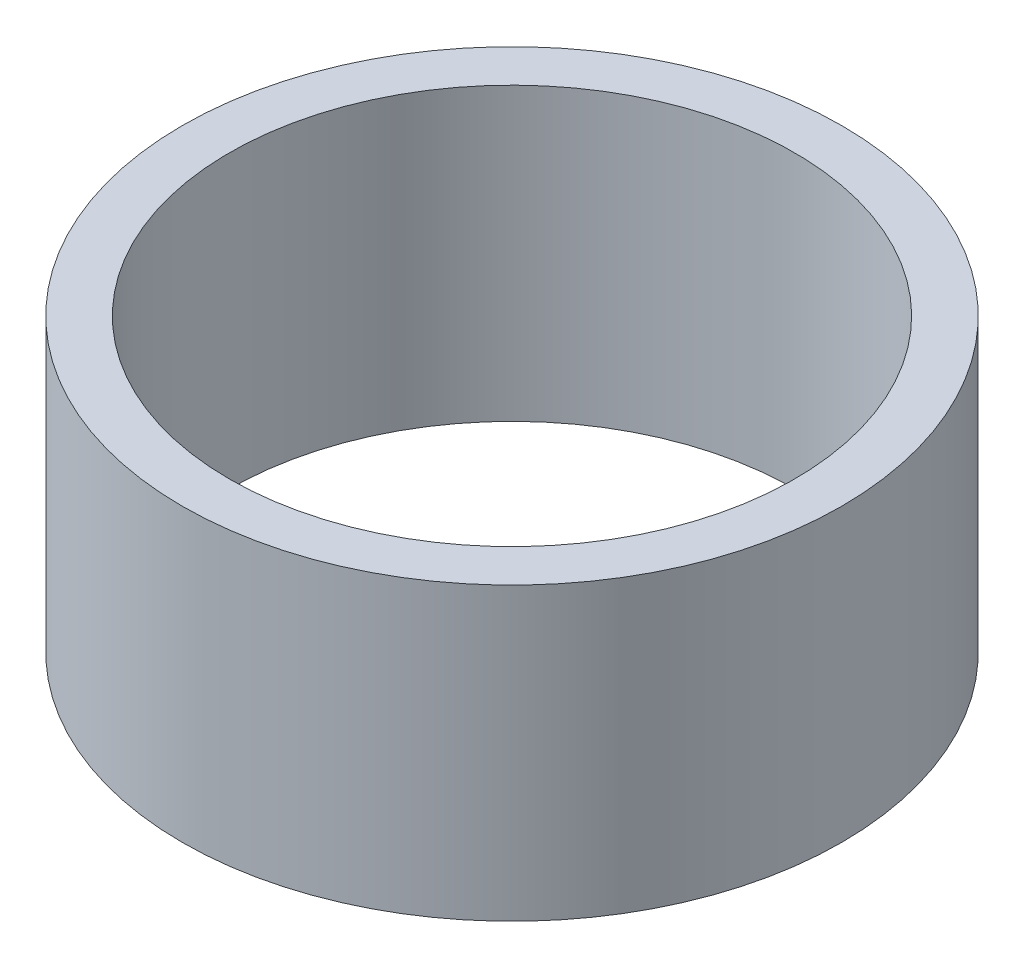
from build123d import *

# Parameters (mm, degrees)
ESBO_O1_R                = 38.5
ESBO_O1_R_2              = 33
RESSALTO_EXTRUS_O1_DEPTH = 34


with BuildPart() as part:
    # Esboço1 → Ressalto-extrusão1 (new body)
    with BuildSketch(Plane(origin=(0, 0, 0), x_dir=(1, 0, 0), z_dir=(0, 1, 0))):
        with Locations(Location((0, 0, 0), (0, 0, 270))):
            Circle(ESBO_O1_R)
        with Locations(Location((0, 0, 0), (0, 0, 270))):
            Circle(ESBO_O1_R_2, mode=Mode.SUBTRACT)
    extrude(amount=RESSALTO_EXTRUS_O1_DEPTH)


solid = part.part
